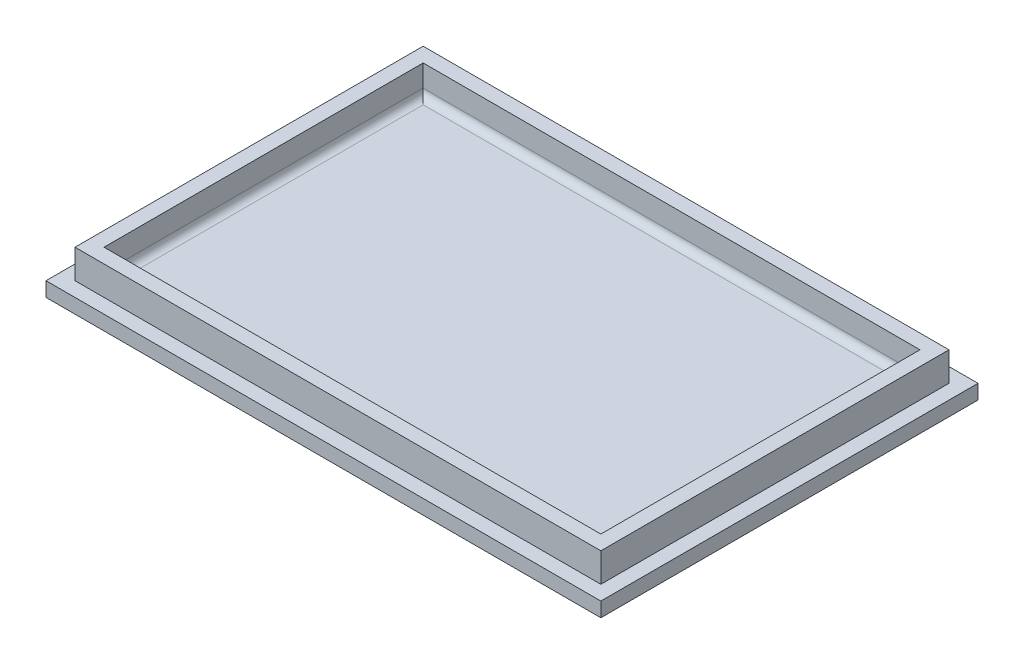
from build123d import *

# Parameters (mm, degrees)
SKETCH_1_W      = 76.5
SKETCH_1_H      = 52
EXTRUDE_1_DEPTH = 2
SKETCH_2_W      = 72.5
SKETCH_2_H      = 48
SKETCH_2_W_2    = 68.5
SKETCH_2_H_2    = 44
EXTRUDE_2_DEPTH = 4
FILLET_1_R      = 1


with BuildPart() as part:
    # Эскиз1 → Бобышка-Вытянуть1 (new body)
    with BuildSketch(Plane(origin=(0, 0, 0), x_dir=(1, 0, 0), z_dir=(0, 1, 0))):
        with Locations((-16.564317774, 1.63491921)):
            Rectangle(SKETCH_1_W, SKETCH_1_H)
    extrude(amount=EXTRUDE_1_DEPTH)

    # Эскиз2 → Бобышка-Вытянуть2 (add)
    with BuildSketch(Plane(origin=(0, 2, 0), x_dir=(1, 0, 0), z_dir=(0, 1, 0))):
        with Locations((-16.564317774, 1.63491921)):
            Rectangle(SKETCH_2_W, SKETCH_2_H)
        with Locations((-16.564317774, 1.63491921)):
            Rectangle(SKETCH_2_W_2, SKETCH_2_H_2, mode=Mode.SUBTRACT)
    extrude(amount=EXTRUDE_2_DEPTH)

    # Скругление1
    fillet_1_edges = [part.edges().sort_by_distance(p)[0] for p in [
        (-50.814317774, 2, -1.63491921),
        (-16.564317774, 2, 20.36508079),
        (17.685682226, 2, -1.63491921),
        (-16.564317774, 2, -23.63491921),
    ]]
    fillet(fillet_1_edges, radius=FILLET_1_R)


solid = part.part
